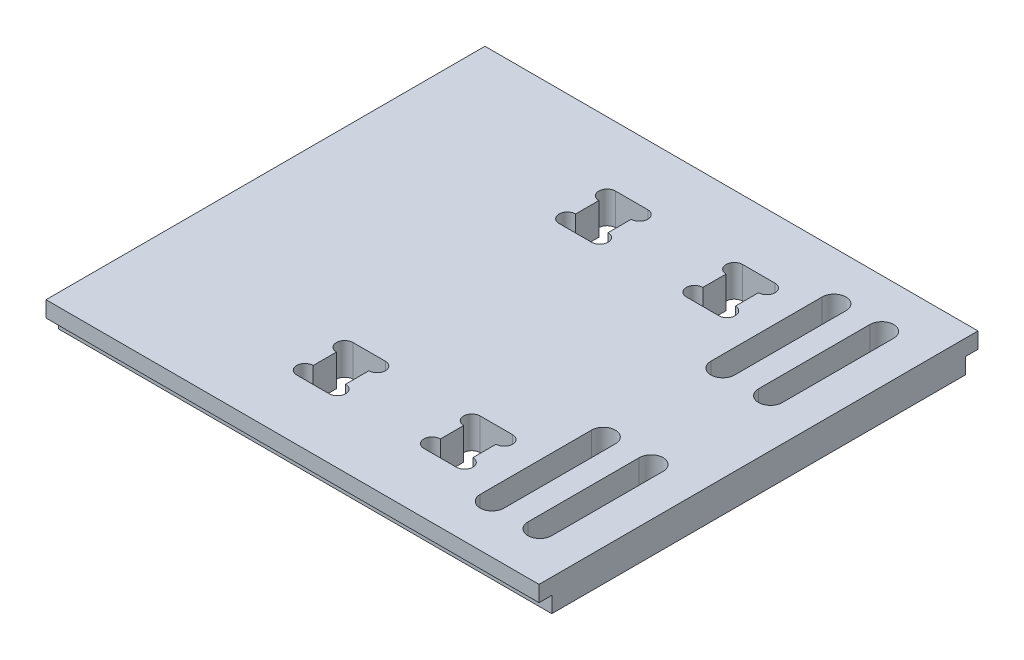
from build123d import *

# Parameters (mm, degrees)
SKETCH1_W           = 175.26
SKETCH1_H           = 12.7
BOSS_EXTRUDE1_DEPTH = 98.425
SKETCH2_W           = 5.08
SKETCH2_H           = 6.35
CUT_EXTRUDE1_DEPTH  = 216.567302483
CUT_EXTRUDE2_DEPTH  = 133.392550867
CUT_EXTRUDE3_DEPTH  = 133.392550867


with BuildPart() as part:
    # Sketch1 → Boss-Extrude1 (new, symmetric)
    with BuildSketch(Plane(origin=(0, 0, 0), x_dir=(0, 0, -1), z_dir=(1, 0, 0))):
        Rectangle(SKETCH1_W, SKETCH1_H)
    extrude(amount=BOSS_EXTRUDE1_DEPTH, both=True)

    # Sketch2 → Cut-Extrude1 (cut, through all)
    with BuildSketch(Plane(origin=(98.425, 0, 0), x_dir=(0, 0, -1), z_dir=(1, 0, 0))):
        with Locations((-85.09, -3.175)):
            Rectangle(SKETCH2_W, SKETCH2_H)
        with Locations((85.09, -3.175)):
            Rectangle(SKETCH2_W, SKETCH2_H)
    extrude(amount=-CUT_EXTRUDE1_DEPTH, mode=Mode.SUBTRACT)

    # Sketch3 → Cut-Extrude2 (cut, through all)
    with BuildSketch(Plane(origin=(0, 6.35, 0), x_dir=(1, 0, 0), z_dir=(0, 1, 0))):
        with BuildLine():
            Line((28.448, -41.148), (41.402, -41.148))
            ThreePointArc((41.402, -41.148), (44.704, -44.45), (41.402, -47.752))
            Line((41.402, -47.752), (41.402, -57.023))
            ThreePointArc((41.402, -57.023), (44.704, -60.325), (41.402, -63.627))
            Line((41.402, -63.627), (28.448, -63.627))
            ThreePointArc((28.448, -63.627), (25.146, -60.325), (28.448, -57.023))
            Line((28.448, -57.023), (28.448, -47.752))
            ThreePointArc((28.448, -47.752), (25.146, -44.45), (28.448, -41.148))
        make_face()
        with BuildLine():
            Line((-22.352, -41.148), (-9.398, -41.148))
            ThreePointArc((-9.398, -41.148), (-6.096, -44.45), (-9.398, -47.752))
            Line((-9.398, -47.752), (-9.398, -57.023))
            ThreePointArc((-9.398, -57.023), (-6.096, -60.325), (-9.398, -63.627))
            Line((-9.398, -63.627), (-22.352, -63.627))
            ThreePointArc((-22.352, -63.627), (-25.654, -60.325), (-22.352, -57.023))
            Line((-22.352, -57.023), (-22.352, -47.752))
            ThreePointArc((-22.352, -47.752), (-25.654, -44.45), (-22.352, -41.148))
        make_face()
        with BuildLine():
            Line((-22.352, 63.627), (-9.398, 63.627))
            ThreePointArc((-9.398, 63.627), (-6.096, 60.325), (-9.398, 57.023))
            Line((-9.398, 57.023), (-9.398, 47.752))
            ThreePointArc((-9.398, 47.752), (-6.096, 44.45), (-9.398, 41.148))
            Line((-9.398, 41.148), (-22.352, 41.148))
            ThreePointArc((-22.352, 41.148), (-25.654, 44.45), (-22.352, 47.752))
            Line((-22.352, 47.752), (-22.352, 57.023))
            ThreePointArc((-22.352, 57.023), (-25.654, 60.325), (-22.352, 63.627))
        make_face()
        with BuildLine():
            Line((28.448, 63.627), (41.402, 63.627))
            ThreePointArc((41.402, 63.627), (44.704, 60.325), (41.402, 57.023))
            Line((41.402, 57.023), (41.402, 47.752))
            ThreePointArc((41.402, 47.752), (44.704, 44.45), (41.402, 41.148))
            Line((41.402, 41.148), (28.448, 41.148))
            ThreePointArc((28.448, 41.148), (25.146, 44.45), (28.448, 47.752))
            Line((28.448, 47.752), (28.448, 57.023))
            ThreePointArc((28.448, 57.023), (25.146, 60.325), (28.448, 63.627))
        make_face()
    extrude(amount=-CUT_EXTRUDE2_DEPTH, mode=Mode.SUBTRACT)

    # Sketch4 → Cut-Extrude3 (cut, through all)
    with BuildSketch(Plane(origin=(0, 6.35, 0), x_dir=(1, 0, 0), z_dir=(0, 1, 0))):
        with BuildLine():
            Line((55.5625, -68.2625), (55.5625, -23.8125))
            ThreePointArc((55.5625, -23.8125), (60.325, -19.05), (65.0875, -23.8125))
            Line((65.0875, -23.8125), (65.0875, -68.2625))
            ThreePointArc((65.0875, -68.2625), (60.325, -73.025), (55.5625, -68.2625))
        make_face()
        with BuildLine():
            Line((55.5625, 23.8125), (55.5625, 68.2625))
            ThreePointArc((55.5625, 68.2625), (60.325, 73.025), (65.0875, 68.2625))
            Line((65.0875, 68.2625), (65.0875, 23.8125))
            ThreePointArc((65.0875, 23.8125), (60.325, 19.05), (55.5625, 23.8125))
        make_face()
        with BuildLine():
            Line((84.1375, 68.2625), (84.1375, 23.8125))
            ThreePointArc((84.1375, 23.8125), (79.375, 19.05), (74.6125, 23.8125))
            Line((74.6125, 23.8125), (74.6125, 68.2625))
            ThreePointArc((74.6125, 68.2625), (79.375, 73.025), (84.1375, 68.2625))
        make_face()
        with BuildLine():
            Line((84.1375, -23.8125), (84.1375, -68.2625))
            ThreePointArc((84.1375, -68.2625), (79.375, -73.025), (74.6125, -68.2625))
            Line((74.6125, -68.2625), (74.6125, -23.8125))
            ThreePointArc((74.6125, -23.8125), (79.375, -19.05), (84.1375, -23.8125))
        make_face()
    extrude(amount=-CUT_EXTRUDE3_DEPTH, mode=Mode.SUBTRACT)


solid = part.part
